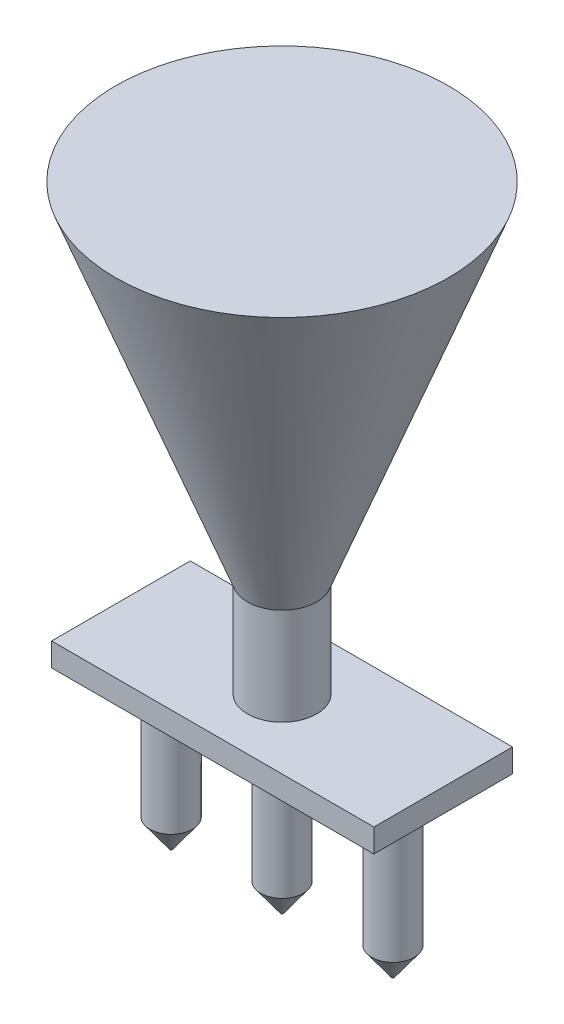
from build123d import *

# Parameters (mm, degrees)
SKETCH1_W           = 232.477284974
SKETCH1_H           = 16.858001952
BOSS_EXTRUDE1_DEPTH = 100
SKETCH2_R           = 25
BOSS_EXTRUDE2_DEPTH = 70
SKETCH5_R           = 20
BOSS_EXTRUDE3_DEPTH = 20
BOSS_EXTRUDE3_TAPER = 13
SKETCH6_R           = 15.382636177
BOSS_EXTRUDE4_DEPTH = 80
SKETCH7_R           = 15.382636177
BOSS_EXTRUDE5_DEPTH = 20
BOSS_EXTRUDE5_TAPER = 36
LPATTERN1_COUNT     = 2
LPATTERN1_PITCH     = 80
LPATTERN2_COUNT     = 2
LPATTERN2_PITCH     = 80
SKETCH9_R           = 120
BOSS_EXTRUDE6_DEPTH = 250
BOSS_EXTRUDE6_DRAFT = -20.8


with BuildPart() as part:
    # Sketch1 → Boss-Extrude1 (new body)
    with BuildSketch(Plane.XY):
        Rectangle(SKETCH1_W, SKETCH1_H)
    extrude(amount=BOSS_EXTRUDE1_DEPTH)

    # Sketch2 → Boss-Extrude2 (add)
    with BuildSketch(Plane(origin=(0, 8.429000976, 0), x_dir=(1, 0, 0), z_dir=(0, 1, 0))):
        with Locations(Location((0, -50, 0), (0, 0, 270))):
            Circle(SKETCH2_R)
    extrude(amount=BOSS_EXTRUDE2_DEPTH)

    # Sketch5 → Boss-Extrude3 (add)
    with BuildSketch(Plane.XZ.offset(8.429000976)):
        with Locations((0, 50)):
            Circle(SKETCH5_R)
    boss_extrude3 = extrude(amount=BOSS_EXTRUDE3_DEPTH, taper=BOSS_EXTRUDE3_TAPER)

    # Sketch6 → Boss-Extrude4 (add)
    with BuildSketch(Plane.XZ.offset(28.429000976)):
        with Locations(Location((0, 50, 0), (0, 0, 270))):
            Circle(SKETCH6_R)
    boss_extrude4 = extrude(amount=BOSS_EXTRUDE4_DEPTH)

    # Sketch7 → Boss-Extrude5 (add)
    with BuildSketch(Plane.XZ.offset(108.429000976)):
        with Locations(Location((0, 50, 0), (0, 0, 270))):
            Circle(SKETCH7_R)
    boss_extrude5 = extrude(amount=BOSS_EXTRUDE5_DEPTH, taper=BOSS_EXTRUDE5_TAPER)

    # LPattern1: Boss-Extrude3, Boss-Extrude4, Boss-Extrude5 ×2
    with Locations(*[(i * LPATTERN1_PITCH, 0, 0) for i in range(1, LPATTERN1_COUNT)]):
        add(boss_extrude3)
        add(boss_extrude4)
        add(boss_extrude5)

    # LPattern2: Boss-Extrude3, Boss-Extrude4, Boss-Extrude5 ×2
    with Locations(*[(-i * LPATTERN2_PITCH, 0, 0) for i in range(1, LPATTERN2_COUNT)]):
        add(boss_extrude3)
        add(boss_extrude4)
        add(boss_extrude5)


with BuildPart() as boss_extrude6_tool:
    # Sketch9 → Boss-Extrude6 (with draft: the straight prism first)
    with BuildSketch(Plane(origin=(0, 328.429000976, 0), x_dir=(1, 0, 0), z_dir=(0, 1, 0))):
        with Locations((0, -50)):
            Circle(SKETCH9_R)
    extrude(amount=-BOSS_EXTRUDE6_DEPTH)
    # Boss-Extrude6: the draft: its side faces are tilted about the plane it starts from
    boss_extrude6_sides = [boss_extrude6_tool.faces().sort_by_distance(p)[0] for p in [
        (-120, 203.429000976, 50),
    ]]
    draft(boss_extrude6_sides, Plane(origin=(0, 328.429000976, 0), x_dir=(1, 0, 0), z_dir=(0, 1, 0)), BOSS_EXTRUDE6_DRAFT)


with BuildPart() as part_1:
    add(part.part)

    # Boss-Extrude6: add boss_extrude6_tool
    add(boss_extrude6_tool.part)


solid = part_1.part
